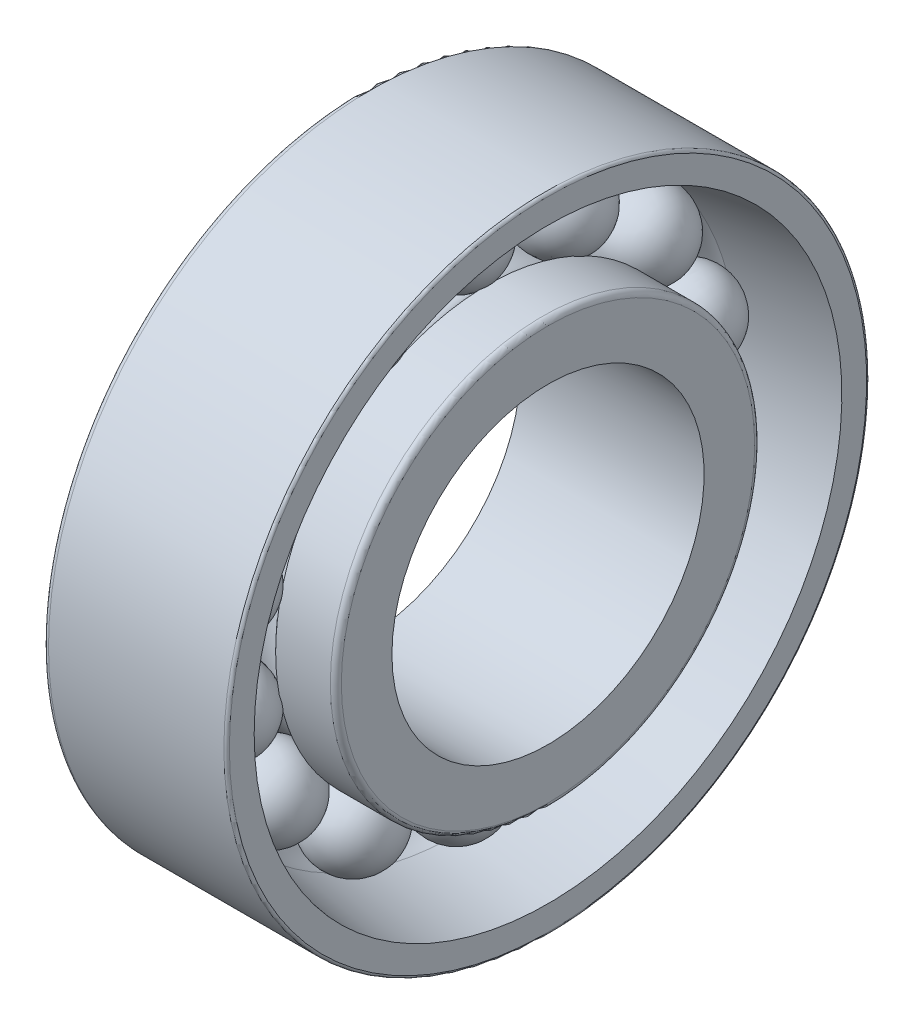
from build123d import *

# Parameters (mm, degrees)
FILLET_1_R               = 0.15
FILLET_2_R               = 0.3
PATTERN_CIRCULAR_2_COUNT = 14


with BuildPart() as part:
    # 草图2 → Revolve 975 (revolve)
    with BuildSketch(Plane.XY, mode=Mode.PRIVATE) as revolve_975_sk:
        with BuildLine():
            Line((0, 17.5), (10, 17.5))
            Line((10, 17.5), (10, 16))
            Line((10, 16), (5, 15.25))
            ThreePointArc((5, 15.25), (4.049108911, 15.039192521), (3.276400003, 14.446272122))
            Line((3.276400003, 14.446272122), (0, 14.446272122))
            Line((0, 14.446272122), (0, 17.5))
        make_face()
    revolve(revolve_975_sk.sketch.rotate(Axis((0, 0, 0), (1, 0, 0)), 90), axis=Axis((0, 0, 0), (1, 0, 0)))

    # 草图3 → 凸台-旋转1 (revolve)
    with BuildSketch(Plane.XY):
        with BuildLine():
            Line((7.3, 13), (2.7, 13))
            ThreePointArc((2.7, 13), (5, 15.3), (7.3, 13))
        make_face()
    revolve_1 = revolve(axis=Axis((0, 13, 0), (1, 0, 0)))

    # 草图4 → 凸台-旋转2 (revolve)
    with BuildSketch(Plane.XY, mode=Mode.PRIVATE) as revolve_2_sk:
        with BuildLine():
            Line((10, 8.5), (10, 11.553727878))
            Line((10, 11.553727878), (6.723599997, 11.553727878))
            ThreePointArc((6.723599997, 11.553727878), (5, 10.75), (3.276400003, 11.553727878))
            Line((3.276400003, 11.553727878), (0, 11.553727878))
            Line((0, 11.553727878), (0, 8.5))
            Line((0, 8.5), (10, 8.5))
        make_face()
    revolve(revolve_2_sk.sketch.rotate(Axis((0, 0, 0), (1, 0, 0)), 90), axis=Axis((0, 0, 0), (1, 0, 0)))

    # 圆角1
    fillet_1_edges = [part.edges().sort_by_distance(p)[0] for p in [
        (10, 0, -17.5),
    ]]
    fillet(fillet_1_edges, radius=FILLET_1_R)

    # 圆角2
    fillet_2_edges = [part.edges().sort_by_distance(p)[0] for p in [
        (10, 0, -11.553727878),
        (0, 0, -17.5),
    ]]
    fillet(fillet_2_edges, radius=FILLET_2_R)

    # 阵列(圆周)2: 凸台-旋转1 ×14 about axis
    pattern_circular_2_axis = Axis((0, 0, 0), (1, 0, 0))
    for i in range(1, PATTERN_CIRCULAR_2_COUNT):
        add(revolve_1.rotate(pattern_circular_2_axis, i * 360 / PATTERN_CIRCULAR_2_COUNT))


solid = part.part
